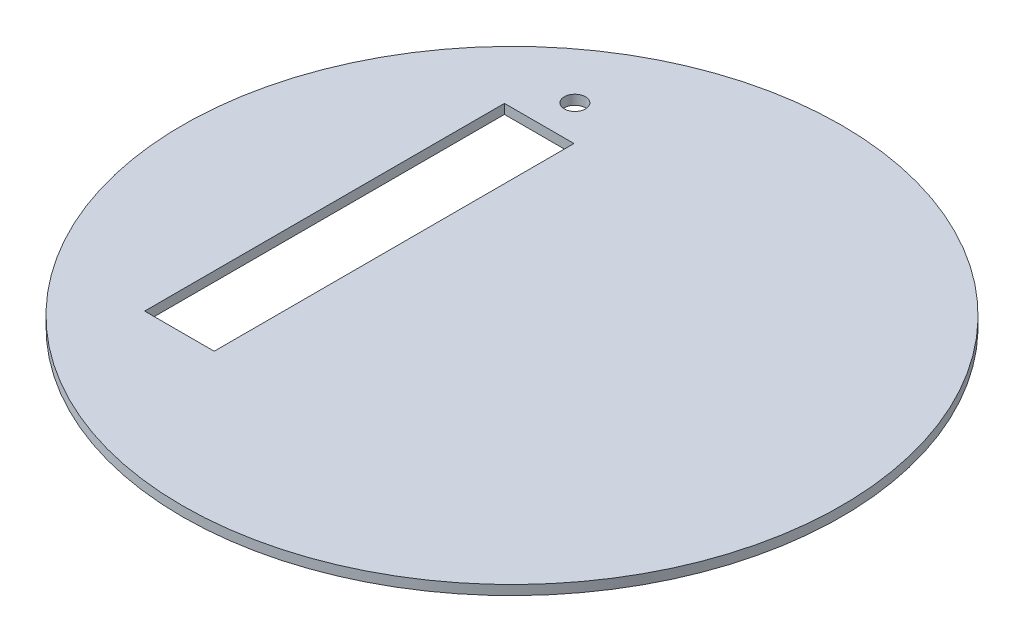
from build123d import *

# Parameters (mm, degrees)
SKETCH1_W          = 109
SKETCH1_H          = 3.18
SKETCH2_R          = 3.5
SKETCH2_W          = 23
SKETCH2_H          = 119
CUT_EXTRUDE1_DEPTH = 155.182075482


with BuildPart() as part:
    # Sketch1 → Revolve1 (revolve)
    with BuildSketch(Plane.XY, mode=Mode.PRIVATE) as revolve1_sk:
        with Locations((54.5, 1.59)):
            Rectangle(SKETCH1_W, SKETCH1_H)
    revolve(revolve1_sk.sketch.rotate(Axis((0, 4.511025306, 0), (0, 1, 0)), 90), axis=Axis((0, 4.511025306, 0), (0, 1, 0)))

    # Sketch2 → Cut-Extrude1 (cut, through all)
    with BuildSketch(Plane(origin=(0, 3.18, 0), x_dir=(1, 0, 0), z_dir=(0, 1, 0))):
        with Locations(Location((-50.5, 71.302237886, 0), (0, 0, 270))):
            Circle(SKETCH2_R)
        with Locations((-50.5, 0)):
            Rectangle(SKETCH2_W, SKETCH2_H)
    extrude(amount=-CUT_EXTRUDE1_DEPTH, mode=Mode.SUBTRACT)


solid = part.part
